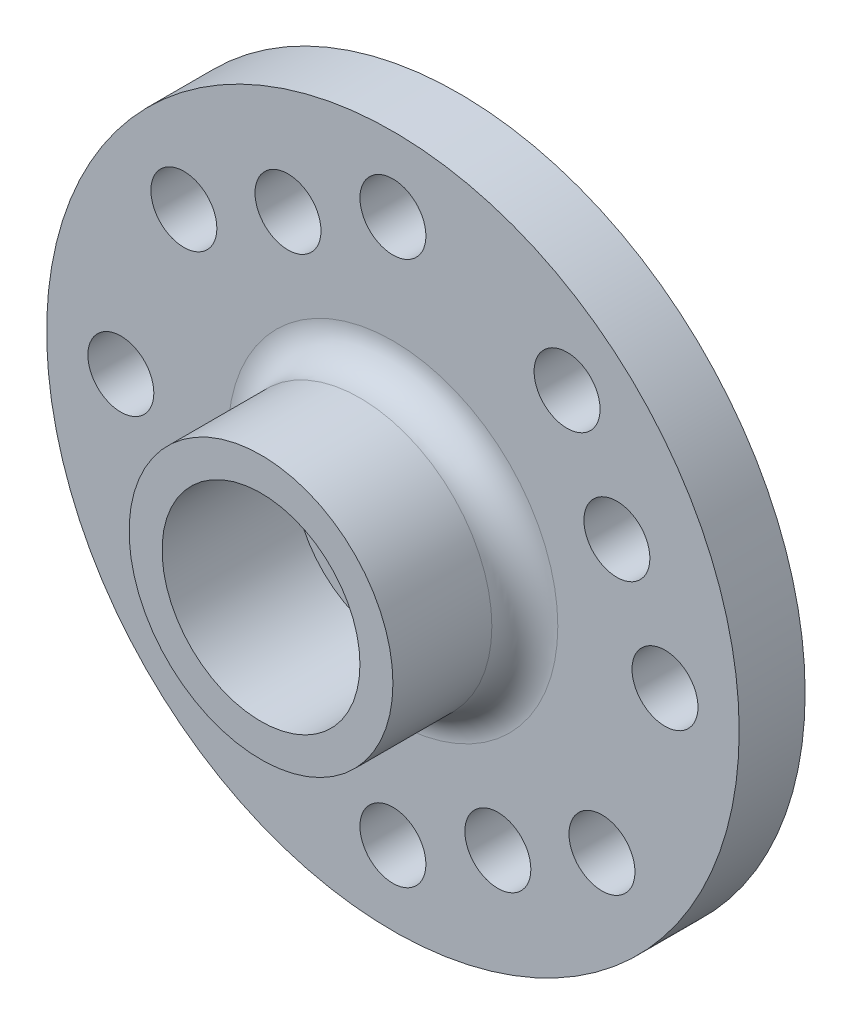
from build123d import *

# Parameters (mm, degrees)
SKETCH_1_R          = 10.5
EXTRUDE_1_DEPTH     = 2
SKETCH_2_R          = 4
SKETCH_2_R_2        = 3
EXTRUDE_2_DEPTH     = 4
SKETCH_5_R          = 1.5
CUT_EXTRUDE_2_DEPTH = 16.378556499
FILLET_1_R          = 1
SKETCH_6_R          = 3.5
EXTRUDE_3_DEPTH     = 0.5
SKETCH_8_R          = 3
CUT_EXTRUDE_3_DEPTH = 1.5
SKETCH_9_R          = 1
CUT_EXTRUDE_5_DEPTH = 17.015617378


with BuildPart() as part:
    # 草圖1 → 伸長1 (new body)
    with BuildSketch(Plane.XY):
        Circle(SKETCH_1_R)
    extrude(amount=EXTRUDE_1_DEPTH)

    # 草圖2 → 伸長2 (add)
    with BuildSketch(Plane.XY.offset(2)):
        Circle(SKETCH_2_R)
        Circle(SKETCH_2_R_2, mode=Mode.SUBTRACT)
    extrude(amount=EXTRUDE_2_DEPTH)

    # 草圖5 → 除料-伸長2 (cut, through all)
    with BuildSketch(Plane.XY.offset(2)):
        Circle(SKETCH_5_R)
    extrude(amount=-CUT_EXTRUDE_2_DEPTH, mode=Mode.SUBTRACT)

    # 圓角1
    fillet_1_edges = [part.edges().sort_by_distance(p)[0] for p in [
        (-4, 0, 2),
    ]]
    fillet(fillet_1_edges, radius=FILLET_1_R)

    # 草圖6 → 伸長3 (add)
    with BuildSketch(Plane(origin=(0, 0, 0), x_dir=(-1, 0, 0), z_dir=(0, 0, -1))):
        with Locations(Location((0, 0, 0), (0, 0, 180))):
            Circle(SKETCH_6_R)
    extrude(amount=EXTRUDE_3_DEPTH)

    # 草圖8 → 除料-伸長3 (cut)
    with BuildSketch(Plane(origin=(0, 0, -0.5), x_dir=(-1, 0, 0), z_dir=(0, 0, -1))):
        with Locations(Location((0, 0, 0), (0, 0, 180))):
            Circle(SKETCH_8_R)
    extrude(amount=-CUT_EXTRUDE_3_DEPTH, mode=Mode.SUBTRACT)

    # 草圖9 → 除料-伸長5 (cut, through all)
    with BuildSketch(Plane(origin=(0, 0, 0), x_dir=(-1, 0, 0), z_dir=(0, 0, -1))):
        with Locations((8.25, 0)):
            Circle(SKETCH_9_R)
        with Locations((0, -8.25)):
            Circle(SKETCH_9_R)
        with Locations((-8.25, 0)):
            Circle(SKETCH_9_R)
        with Locations((0, 8.25)):
            Circle(SKETCH_9_R)
        with Locations((5.28030303, -6.338840581)):
            Circle(SKETCH_9_R)
        with Locations((-6.338840581, -5.28030303)):
            Circle(SKETCH_9_R)
        with Locations((-5.28030303, 6.338840581)):
            Circle(SKETCH_9_R)
        with Locations((6.338840581, 5.28030303)):
            Circle(SKETCH_9_R)
        with Locations((6.791614908, -3.181818182)):
            Circle(SKETCH_9_R)
        with Locations((-3.181818182, -6.791614908)):
            Circle(SKETCH_9_R)
        with Locations((-6.791614908, 3.181818182)):
            Circle(SKETCH_9_R)
        with Locations((3.181818182, 6.791614908)):
            Circle(SKETCH_9_R)
    extrude(amount=-CUT_EXTRUDE_5_DEPTH, mode=Mode.SUBTRACT)


solid = part.part
